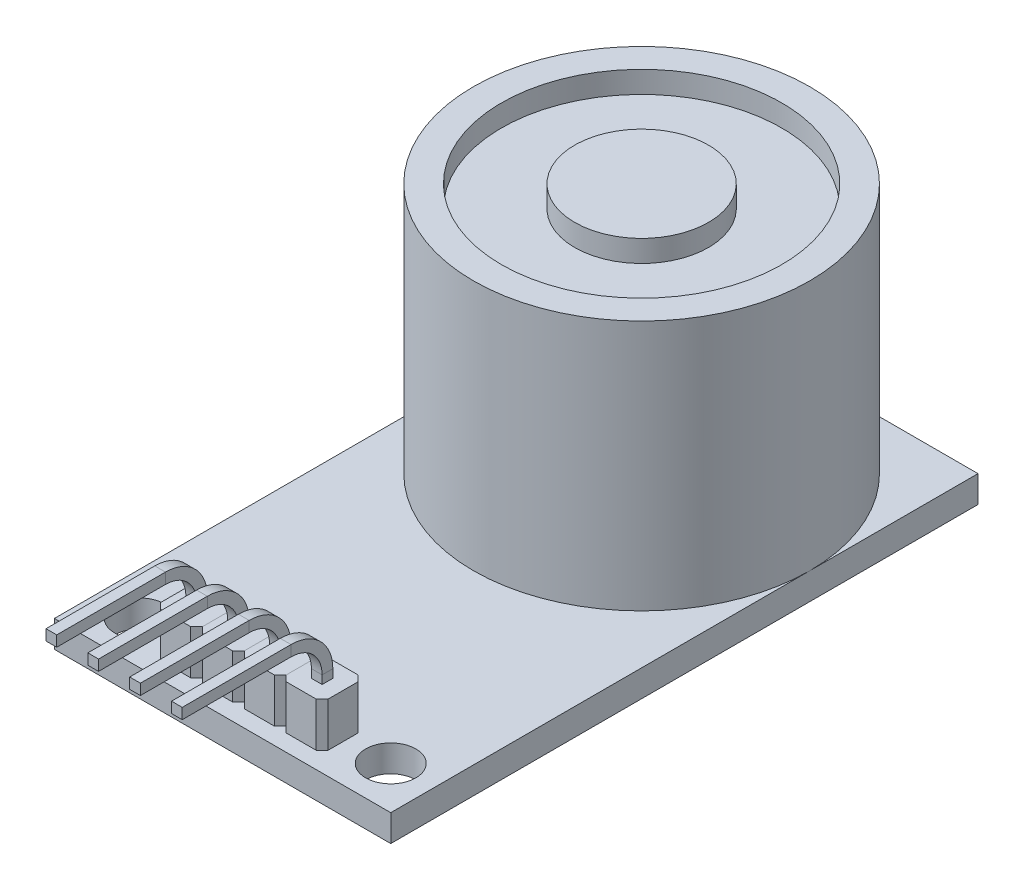
from build123d import *

# Parameters (mm, degrees)
SKETCH1_W           = 20.1
SKETCH1_H           = 35.09
BOSS_EXTRUDE1_DEPTH = 1.6
SKETCH2_R           = 10.05
BOSS_EXTRUDE2_DEPTH = 15
BOSS_EXTRUDE3_DEPTH = 2.65
SKETCH4_W           = 0.64
SKETCH4_H           = 0.64
LPATTERN1_COUNT     = 4
LPATTERN1_PITCH     = 2.5
SKETCH59_R          = 1.5
CUT_EXTRUDE1_DEPTH  = 31.013373788
SKETCH60_R          = 8.375
SKETCH60_R_2        = 4
CUT_EXTRUDE2_DEPTH  = 1.3


with BuildPart() as part:
    # Sketch1 → Boss-Extrude1 (new body)
    with BuildSketch(Plane(origin=(0, 0, 0), x_dir=(1, 0, 0), z_dir=(0, 1, 0))):
        Rectangle(SKETCH1_W, SKETCH1_H)
    extrude(amount=BOSS_EXTRUDE1_DEPTH)

    # Sketch2 → Boss-Extrude2 (add)
    with BuildSketch(Plane(origin=(0, 1.6, 0), x_dir=(1, 0, 0), z_dir=(0, 1, 0))):
        with Locations(Location((0, 7.495, 0), (0, 0, 90))):
            Circle(SKETCH2_R)
    extrude(amount=BOSS_EXTRUDE2_DEPTH)

    # Sketch3 → Boss-Extrude3 (add)
    with BuildSketch(Plane(origin=(0, 1.6, 0), x_dir=(1, 0, 0), z_dir=(0, 1, 0))):
        Polygon((-4.696446609, -14.045), (-2.903575031, -14.045), (-2.550043283, -14.398575031), (-2.550043283, -16.191446609), (-2.903596673, -16.545), (-4.696468251, -16.545), (-5.05, -16.191424969), (-5.05, -14.398553391), align=None)
    boss_extrude3 = extrude(amount=BOSS_EXTRUDE3_DEPTH)

    # Sweep1: sweep along a path in Sketch58
    with BuildLine(Plane.ZY.offset(3.800032462)) as sweep1_path:
        Line((23.97498918, 7.25), (17.47498918, 7.25))
        ThreePointArc((17.47498918, 7.25), (15.707222227, 6.517766953), (14.97498918, 4.75))
        Line((14.97498918, 4.75), (14.97498918, 4.25))
    # Sketch4 → Sweep1 (sweep)
    with BuildSketch(Plane(origin=(0, 4.25, 0), x_dir=(1, 0, 0), z_dir=(0, 1, 0))):
        with Locations((-3.800032462, -15.29498918)):
            Rectangle(SKETCH4_W, SKETCH4_H)
    sweep1 = sweep(path=sweep1_path.line)

    # LPattern1: Boss-Extrude3, Sweep1 ×4
    with Locations(*[(i * LPATTERN1_PITCH, 0, 0) for i in range(1, LPATTERN1_COUNT)]):
        add(boss_extrude3)
        add(sweep1)

    # Sketch59 → Cut-Extrude1 (cut, through all)
    with BuildSketch(Plane(origin=(0, 1.6, 0), x_dir=(1, 0, 0), z_dir=(0, 1, 0))):
        with Locations(Location((-7.5, -14.995, 0), (0, 0, 270))):
            Circle(SKETCH59_R)
        with Locations(Location((7.5, -14.995, 0), (0, 0, 270))):
            Circle(SKETCH59_R)
    extrude(amount=-CUT_EXTRUDE1_DEPTH, mode=Mode.SUBTRACT)

    # Sketch60 → Cut-Extrude2 (cut)
    with BuildSketch(Plane(origin=(0, 16.6, 0), x_dir=(1, 0, 0), z_dir=(0, 1, 0))):
        with Locations(Location((0, 7.495, 0), (0, 0, 270))):
            Circle(SKETCH60_R)
        with Locations(Location((0, 7.495, 0), (0, 0, 270))):
            Circle(SKETCH60_R_2, mode=Mode.SUBTRACT)
    extrude(amount=-CUT_EXTRUDE2_DEPTH, mode=Mode.SUBTRACT)


solid = part.part
